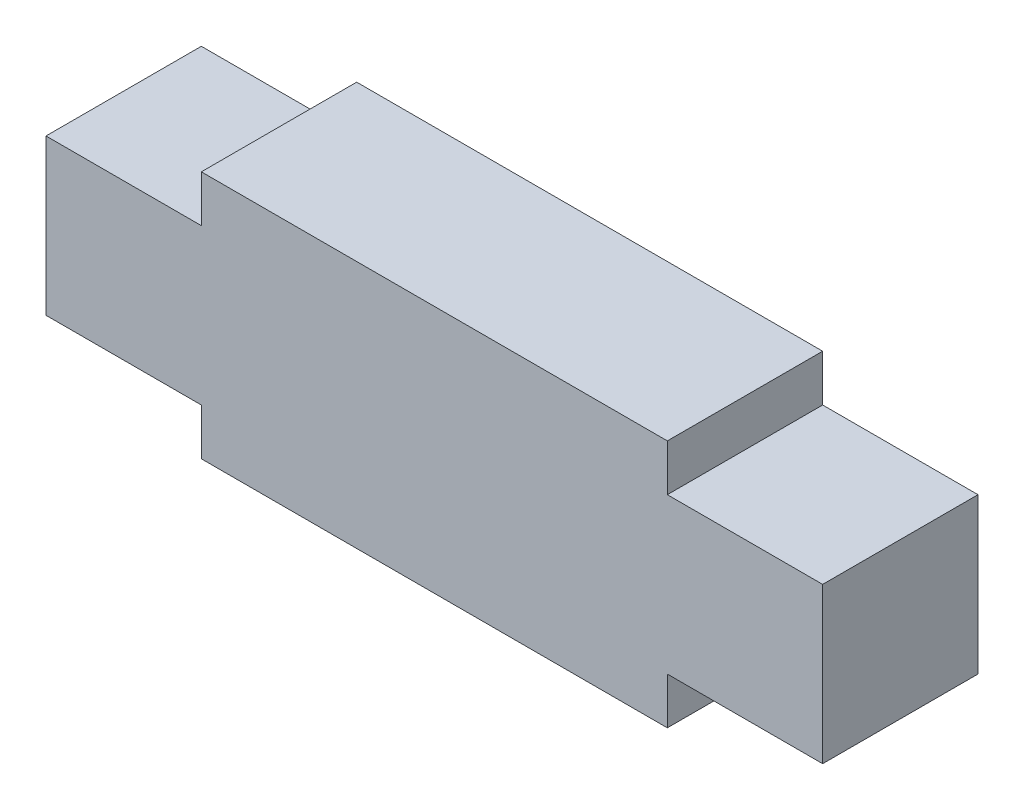
from build123d import *

# Parameters (mm, degrees)
BOSS_EXTRUDE1_DEPTH = 5


with BuildPart() as part:
    # Sketch1 → Boss-Extrude1 (new body)
    with BuildSketch(Plane.XY):
        Polygon((0, 8), (0, 6.5), (-5, 6.5), (-5, 1.5), (0, 1.5), (0, 0), (15, 0), (15, 1.5), (20, 1.5), (20, 6.5), (15, 6.5), (15, 8), align=None)
    extrude(amount=BOSS_EXTRUDE1_DEPTH)


solid = part.part
